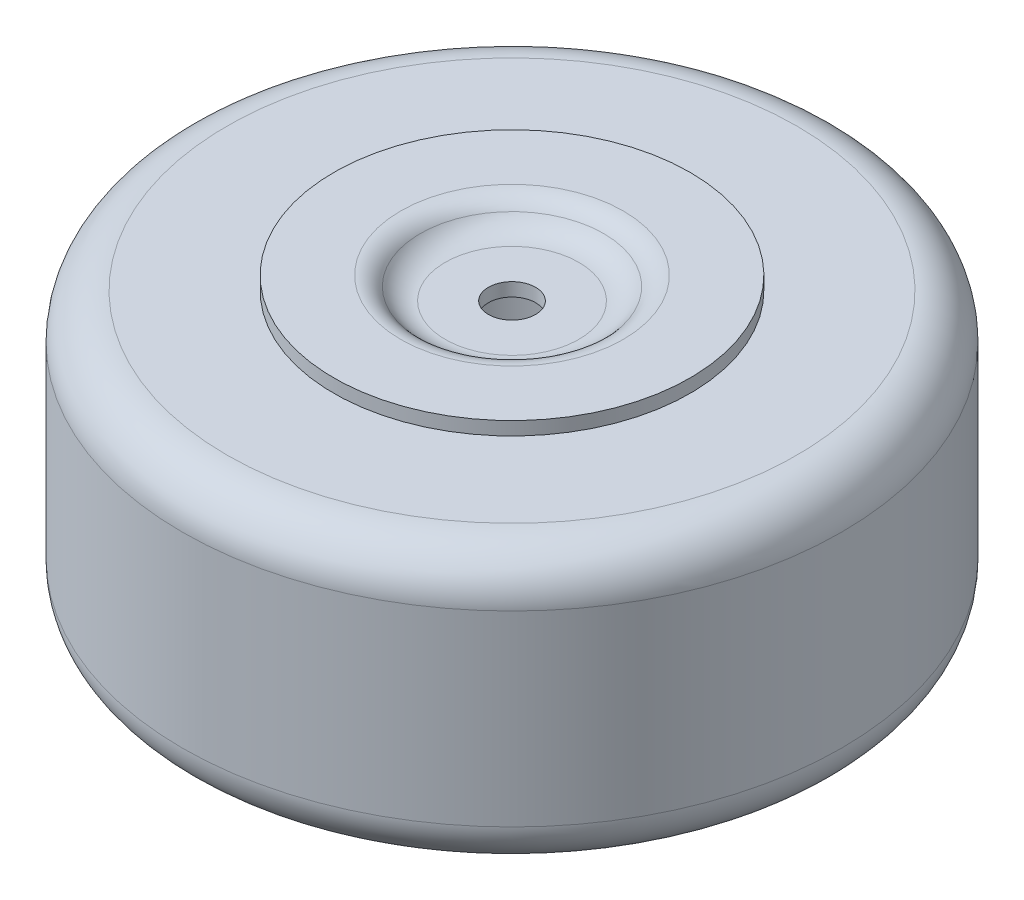
from build123d import *

# Parameters (mm, degrees)
SKETCH3_R          = 2.65
CUT_EXTRUDE1_DEPTH = 60.583974418


with BuildPart() as part:
    # Sketch1 → Revolve1 (revolve)
    with BuildSketch(Plane(origin=(0, 0, 0), x_dir=(0, 0, -1), z_dir=(1, 0, 0)), mode=Mode.PRIVATE) as revolve1_sk:
        with BuildLine():
            Line((-2.65, 20.5), (-2.65, 10.5))
            Line((-2.65, 10.5), (-9.5, 10.5))
            Line((-9.5, 10.5), (-9.5, 5))
            ThreePointArc((-9.5, 5), (-10.964466094, 1.464466094), (-14.5, 0))
            Line((-14.5, 0), (-32, 0))
            ThreePointArc((-32, 0), (-35.535533906, 1.464466094), (-37, 5))
            Line((-37, 5), (-37, 26))
            ThreePointArc((-37, 26), (-35.535533906, 29.535533906), (-32, 31))
            Line((-32, 31), (-14.5, 31))
            ThreePointArc((-14.5, 31), (-10.964466094, 29.535533906), (-9.5, 26))
            Line((-9.5, 26), (-9.5, 20.5))
            Line((-9.5, 20.5), (-2.65, 20.5))
        make_face()
    revolve(revolve1_sk.sketch.rotate(Axis((0, 0, 0), (0, 1, 0)), 180), axis=Axis((0, 0, 0), (0, 1, 0)))


with BuildPart() as body_2:
    # Sketch2 → Revolve2 (revolve)
    with BuildSketch(Plane(origin=(0, 0, 0), x_dir=(0, 0, -1), z_dir=(1, 0, 0)), mode=Mode.PRIVATE) as revolve2_sk:
        with BuildLine():
            Line((-20, 31), (-12.5, 31))
            ThreePointArc((-12.5, 31), (-11.940983006, 30.868033989), (-11.5, 30.5))
            ThreePointArc((-11.5, 30.5), (-9.736067977, 29.027864045), (-7.5, 28.5))
            Line((-7.5, 28.5), (0, 28.5))
            Line((0, 28.5), (0, 30))
            Line((0, 30), (-7.5, 30))
            ThreePointArc((-7.5, 30), (-9.065247584, 30.369504832), (-10.3, 31.4))
            ThreePointArc((-10.3, 31.4), (-11.270162612, 32.209674775), (-12.5, 32.5))
            Line((-12.5, 32.5), (-20, 32.5))
            Line((-20, 32.5), (-20, 31))
        make_face()
    revolve(revolve2_sk.sketch.rotate(Axis((0, 0, 0), (0, 1, 0)), 180), axis=Axis((0, 0, 0), (0, 1, 0)))

    # Sketch3 → Cut-Extrude1 (cut, through all)
    with BuildSketch(Plane.XZ.offset(-28.5)):
        with Locations(Location((0, 0, 0), (0, 0, 270))):
            Circle(SKETCH3_R)
    extrude(amount=-CUT_EXTRUDE1_DEPTH, mode=Mode.SUBTRACT)


solid = Compound([part.part, body_2.part])
